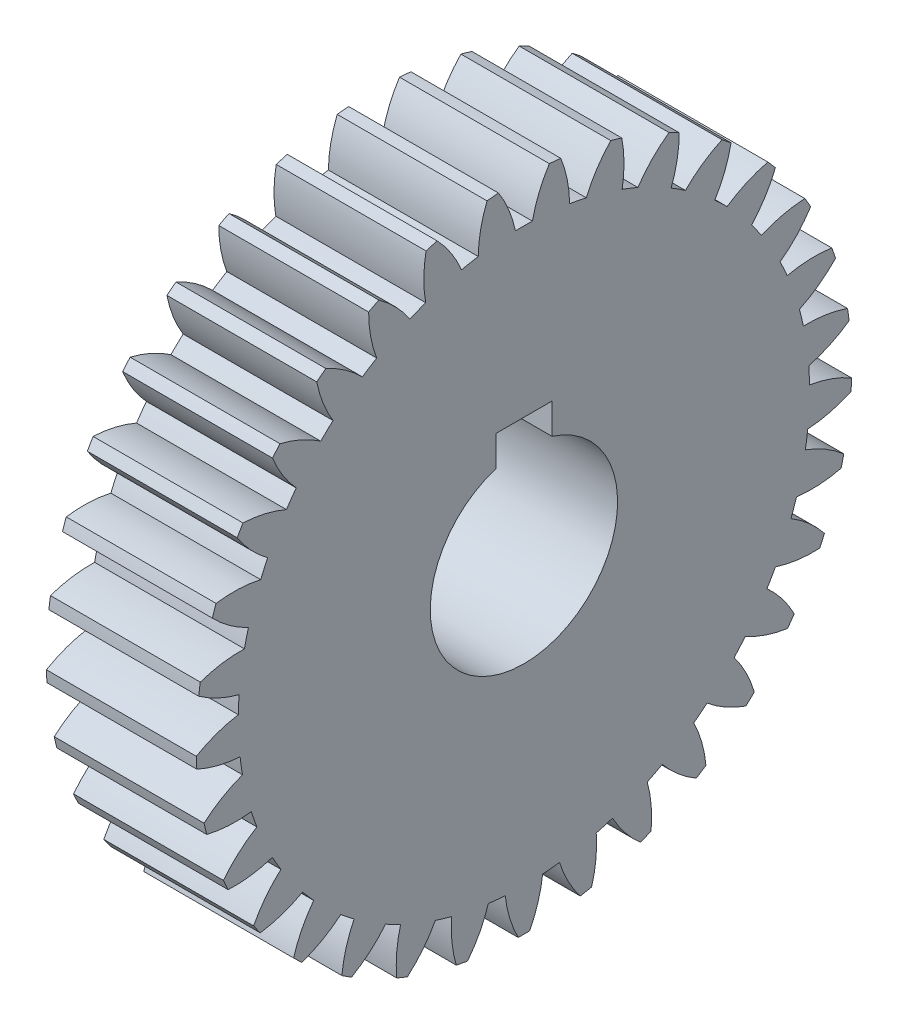
from build123d import *

# Parameters (mm, degrees)
BASPROSKE_W     = 16
BASPROSKE_H     = 35
TOOTHCUT_DEPTH  = 53.019227215
TEETHCUTS_COUNT = 33
TEETHCUTS_ANGLE = 349.090909091
BORSKE_R        = 10
BORE_DEPTH      = 50.0000508
KEYSKE_W        = 6
KEYSKE_H        = 12.8
KEYWAY_DEPTH    = 50.0000508


with BuildPart() as part:
    # BasProSke → Base-Revolve (revolve)
    with BuildSketch(Plane(origin=(0, 0, 0), x_dir=(1, 0, 0), z_dir=(0, 1, 0)), mode=Mode.PRIVATE) as base_revolve_sk:
        with Locations((8, 17.5)):
            Rectangle(BASPROSKE_W, BASPROSKE_H)
    revolve(base_revolve_sk.sketch.rotate(Axis((-10, 0, 0), (1, 0, 0)), 180), axis=Axis((-10, 0, 0), (1, 0, 0)))

    # TooCutSke → ToothCut (cut, through all)
    with BuildSketch(Plane(origin=(0, 0, 0), x_dir=(0, 0, -1), z_dir=(1, 0, 0))):
        with BuildLine():
            ThreePointArc((0.905724209, 30.485548456), (0, 30.499), (-0.905724209, 30.485548456))
            ThreePointArc((-0.905724209, 30.485548456), (-1.615561414, 32.785724392), (-2.731318558, 34.918742018))
            ThreePointArc((-2.731318558, 34.918742018), (0, 35.0254), (2.731318558, 34.918742018))
            ThreePointArc((2.731318558, 34.918742018), (1.615561414, 32.785724392), (0.905724209, 30.485548456))
        make_face()
    toothcut = extrude(amount=TOOTHCUT_DEPTH, mode=Mode.SUBTRACT)

    # TeethCuts: ToothCut ×33 about axis
    teethcuts_axis = Axis((-10, 0, 0), (1, 0, 0))
    for i in range(1, TEETHCUTS_COUNT):
        add(toothcut.rotate(teethcuts_axis, i * TEETHCUTS_ANGLE / (TEETHCUTS_COUNT - 1)), mode=Mode.SUBTRACT)

    # BorSke → Bore (cut, symmetric)
    with BuildSketch(Plane(origin=(0, 0, 0), x_dir=(0, 0, -1), z_dir=(1, 0, 0))):
        with Locations(Location((0, 0, 0), (0, 0, 180))):
            Circle(BORSKE_R)
    extrude(amount=BORE_DEPTH, both=True, mode=Mode.SUBTRACT)

    # KeySke → Keyway (cut, symmetric)
    with BuildSketch(Plane(origin=(0, 0, 0), x_dir=(0, 0, -1), z_dir=(1, 0, 0))):
        with Locations((0, 6.4)):
            Rectangle(KEYSKE_W, KEYSKE_H)
    extrude(amount=KEYWAY_DEPTH, both=True, mode=Mode.SUBTRACT)


solid = part.part
